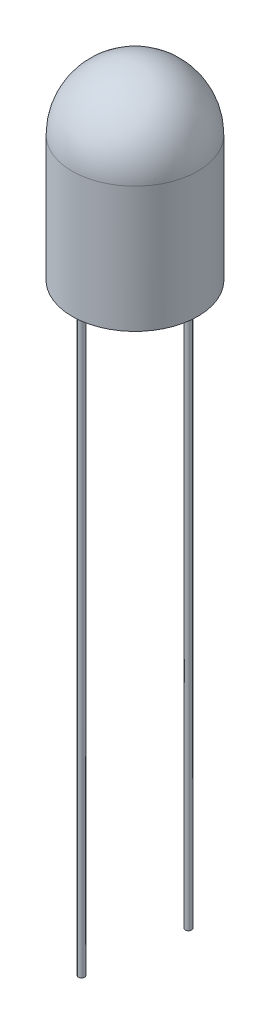
from build123d import *

# Parameters (mm, degrees)
SKETCH2_R           = 0.05
BOSS_EXTRUDE1_DEPTH = 10
SKETCH2_3_R         = 0.05
BOSS_EXTRUDE2_DEPTH = 8.5


with BuildPart() as part:
    # Sketch1 → Revolve1 (revolve)
    with BuildSketch(Plane.XY):
        with BuildLine():
            Line((0, 0), (1, 0))
            Line((1, 0), (1, 2))
            ThreePointArc((1, 2), (0.707106781, 2.707106781), (0, 3))
            Line((0, 3), (0, 0))
        make_face()
    revolve(axis=Axis((0, 4.374977091, 0), (0, -1, 0)))

    # Sketch2 → Boss-Extrude1 (add)
    with BuildSketch(Plane.XZ):
        with Locations((-0.85, 0)):
            Circle(SKETCH2_R)
    extrude(amount=BOSS_EXTRUDE1_DEPTH)

    # Sketch2<3> → Boss-Extrude2 (add)
    with BuildSketch(Plane.XZ):
        with Locations((0.85, 0)):
            Circle(SKETCH2_3_R)
    extrude(amount=BOSS_EXTRUDE2_DEPTH)


solid = part.part
